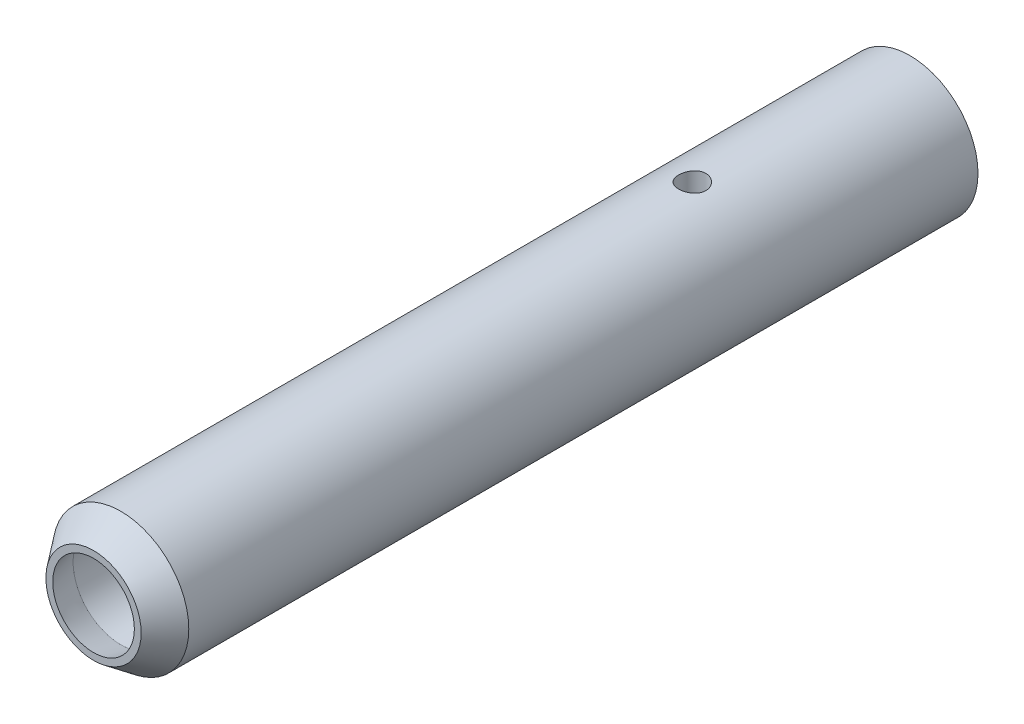
from build123d import *

# Parameters (mm, degrees)
SKETCH1_R           = 6.35
SKETCH1_R_2         = 3.175
BOSS_EXTRUDE1_DEPTH = 25.4
BOSS_EXTRUDE2_START = -7.62
SKETCH2_R           = 6.35
BOSS_EXTRUDE2_DEPTH = 7.62
SKETCH4_R           = 4.445
CUT_EXTRUDE2_DEPTH  = 27.94
BOSS_EXTRUDE4_START = 22.86
SKETCH6_R           = 6.35
SKETCH6_R_2         = 4.445
BOSS_EXTRUDE4_DEPTH = 22.86
SKETCH8_R           = 6.35
SKETCH9_R           = 4.445
SKETCH8_7_R         = 4.445
SKETCH9_7_R         = 3.81
SKETCH3_R           = 1.27


with BuildPart() as part:
    # Sketch1 → Boss-Extrude1 (new, symmetric)
    with BuildSketch(Plane.XY):
        Circle(SKETCH1_R)
        Circle(SKETCH1_R_2, mode=Mode.SUBTRACT)
    extrude(amount=BOSS_EXTRUDE1_DEPTH, both=True)

    # Sketch2 → Boss-Extrude2 (add)
    with BuildSketch(Plane(origin=(0, 0, -10.16), x_dir=(-1, 0, 0), z_dir=(0, 0, -1)).offset(BOSS_EXTRUDE2_START)):
        with Locations(Location((0, 0, 0), (0, 0, 180))):
            Circle(SKETCH2_R)
    extrude(amount=BOSS_EXTRUDE2_DEPTH)

    # Sketch4 → Cut-Extrude2 (cut)
    with BuildSketch(Plane.XY.offset(25.4)):
        Circle(SKETCH4_R)
    extrude(amount=-CUT_EXTRUDE2_DEPTH, mode=Mode.SUBTRACT)

    # Sketch6 → Boss-Extrude4 (add)
    with BuildSketch(Plane.XY.offset(25.4).offset(BOSS_EXTRUDE4_START)):
        Circle(SKETCH6_R)
        Circle(SKETCH6_R_2, mode=Mode.SUBTRACT)
    extrude(amount=-BOSS_EXTRUDE4_DEPTH)

    # Cut-Sweep1: sweep along a path in Sketch12
    with BuildLine(Plane(origin=(0, 0, 0), x_dir=(0, 0, -1), z_dir=(1, 0, 0))) as cut_sweep1_path:
        Line((2.54, 0), (3.81, 0))
        ThreePointArc((3.81, 0), (4.708025612, 0.371974388), (5.08, 1.27))
        Line((5.08, 1.27), (5.08, 6.35))
    # Sketch3 → Cut-Sweep1 (sweep, cut)
    with BuildSketch(Plane(origin=(0, 6.35, 0), x_dir=(1, 0, 0), z_dir=(0, 1, 0))):
        with Locations((0, 5.08)):
            Circle(SKETCH3_R)
    sweep(path=cut_sweep1_path.line, mode=Mode.SUBTRACT)


with BuildPart() as body_2:
    # Sketch8 → Loft1 section 0
    with BuildSketch(Plane.XY.offset(48.26)):
        Circle(SKETCH8_R)
    # Sketch9 → Loft1 section 1
    with BuildSketch(Plane.XY.offset(50.8)):
        Circle(SKETCH9_R)
    loft()

    # Sketch8<7> → Cut-Loft1 section 0
    with BuildSketch(Plane.XY.offset(48.26)):
        Circle(SKETCH8_7_R)
    # Sketch9<7> → Cut-Loft1 section 1
    with BuildSketch(Plane.XY.offset(50.8)):
        Circle(SKETCH9_7_R)
    loft(mode=Mode.SUBTRACT)


solid = Compound([part.part, body_2.part])
